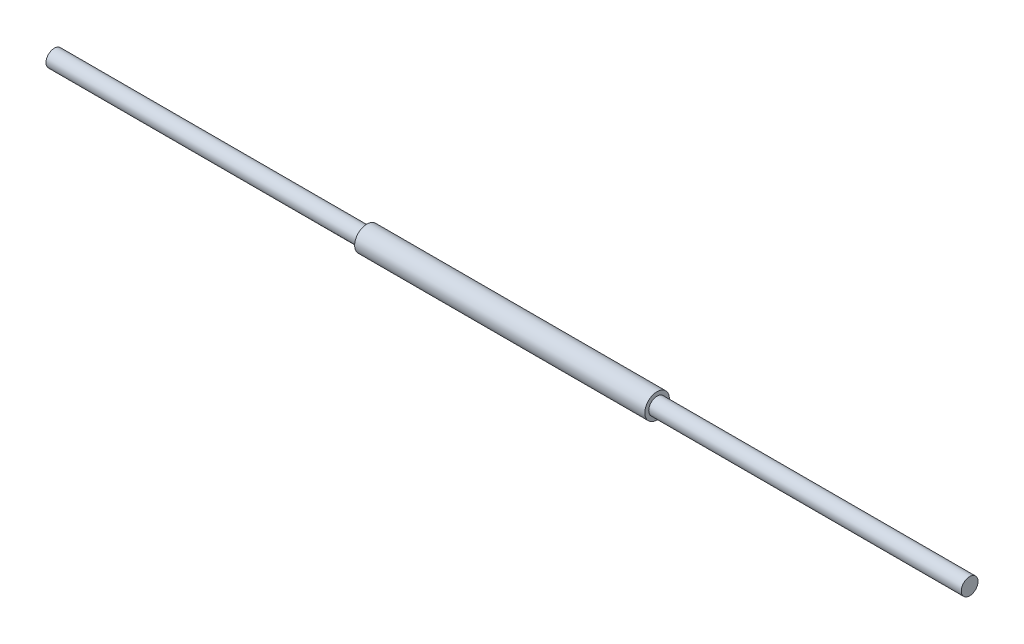
from build123d import *

# Parameters (mm, degrees)
SKETCH1_W   = 177.8
SKETCH1_H   = 4.7625
SKETCH1_W_2 = 165.1
SKETCH1_H_2 = 6.985


with BuildPart() as part:
    # Sketch1 → Revolve1 (revolve)
    with BuildSketch(Plane.XY):
        with Locations((-171.45, -1.11125)):
            Rectangle(SKETCH1_W, SKETCH1_H)
        Rectangle(SKETCH1_W_2, SKETCH1_H_2)
        with Locations((171.45, -1.11125)):
            Rectangle(SKETCH1_W, SKETCH1_H)
    revolve(axis=Axis((-82.55, -3.4925, 0), (-1, 0, 0)))


solid = part.part
